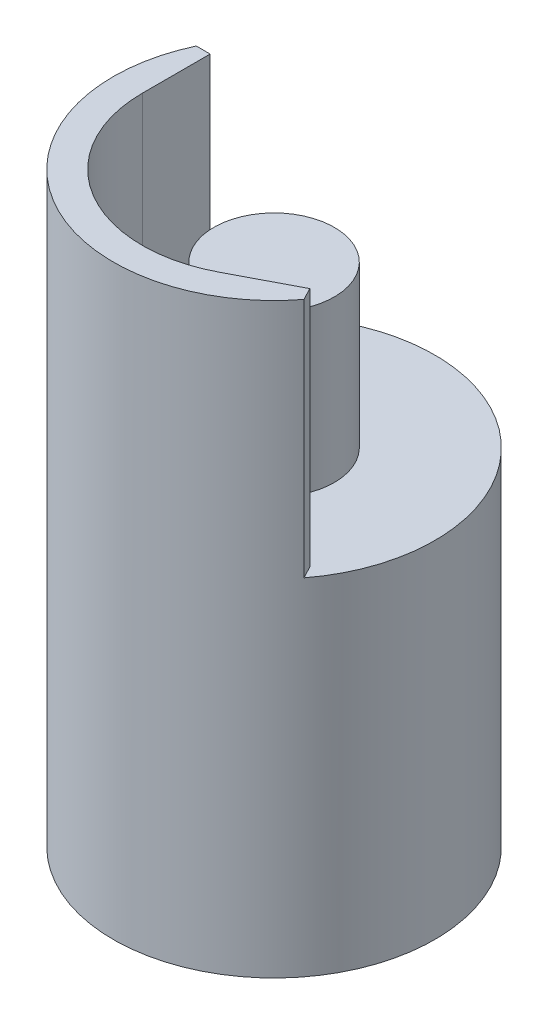
from build123d import *

# Parameters (mm, degrees)
SKETCH1_R           = 10
SKETCH1_R_2         = 8.018181818
BOSS_EXTRUDE1_DEPTH = 21.5
BOSS_EXTRUDE2_DEPTH = 15
SKETCH3_R           = 3.75
BOSS_EXTRUDE3_DEPTH = 10
BOSS_EXTRUDE4_DEPTH = 1.5


with BuildPart() as part:
    # Sketch1 → Boss-Extrude1 (new body)
    # profile 1 of 2: a face of its own
    with BuildSketch(Plane(origin=(0, 0, 0), x_dir=(1, 0, 0), z_dir=(0, 1, 0))):
        with Locations(Location((0, 0, 0), (0, 0, 270))):
            Circle(SKETCH1_R)
        Circle(SKETCH1_R_2, mode=Mode.SUBTRACT)
    # profile 2 of 2: a face of its own
    with BuildSketch(Plane(origin=(0, 0, 0), x_dir=(1, 0, 0), z_dir=(0, 1, 0))):
        Circle(SKETCH1_R_2)
    extrude(amount=BOSS_EXTRUDE1_DEPTH)

    # Sketch2 → Boss-Extrude2 (add)
    with BuildSketch(Plane(origin=(0, 21.5, 0), x_dir=(1, 0, 0), z_dir=(0, 1, 0))):
        with BuildLine():
            ThreePointArc((3.849666815, -7.240170261), (-4.223312214, -7.028771866), (-8.2, 0))
            Line((-8.2, 0), (-8.2, 4.223635209))
            Line((-8.2, 4.223635209), (-9.064265311, 4.223635209))
            ThreePointArc((-9.064265311, 4.223635209), (-5.183292284, -8.551811568), (7.938142814, -6.081602475))
            Line((7.938142814, -6.081602475), (7.538265506, -5.315317068))
            Line((7.538265506, -5.315317068), (3.849666815, -7.240170261))
        make_face()
    extrude(amount=BOSS_EXTRUDE2_DEPTH)

    # Sketch3 → Boss-Extrude3 (add)
    with BuildSketch(Plane(origin=(0, 21.5, 0), x_dir=(1, 0, 0), z_dir=(0, 1, 0))):
        with Locations(Location((0, 0, 0), (0, 0, 270))):
            Circle(SKETCH3_R)
    extrude(amount=BOSS_EXTRUDE3_DEPTH)

    # Sketch4 → Boss-Extrude4 (add)
    with BuildSketch(Plane(origin=(0, 0, 0), x_dir=(1, 0, 0), z_dir=(0, 1, 0))):
        with BuildLine():
            ThreePointArc((-0.680367431, 12.982183952), (-9.429866823, 8.948609484), (-13, 0))
            Line((-13, 0), (-10, 0))
            ThreePointArc((-10, 0), (-9.99657325, 0.261769483), (-9.986295348, 0.523359562))
            ThreePointArc((-9.986295348, 0.523359562), (-7.071067812, 7.071067812), (-0.523359562, 9.986295348))
            Line((-0.523359562, 9.986295348), (-0.680367431, 12.982183952))
        make_face()
    extrude(amount=BOSS_EXTRUDE4_DEPTH)


solid = part.part
